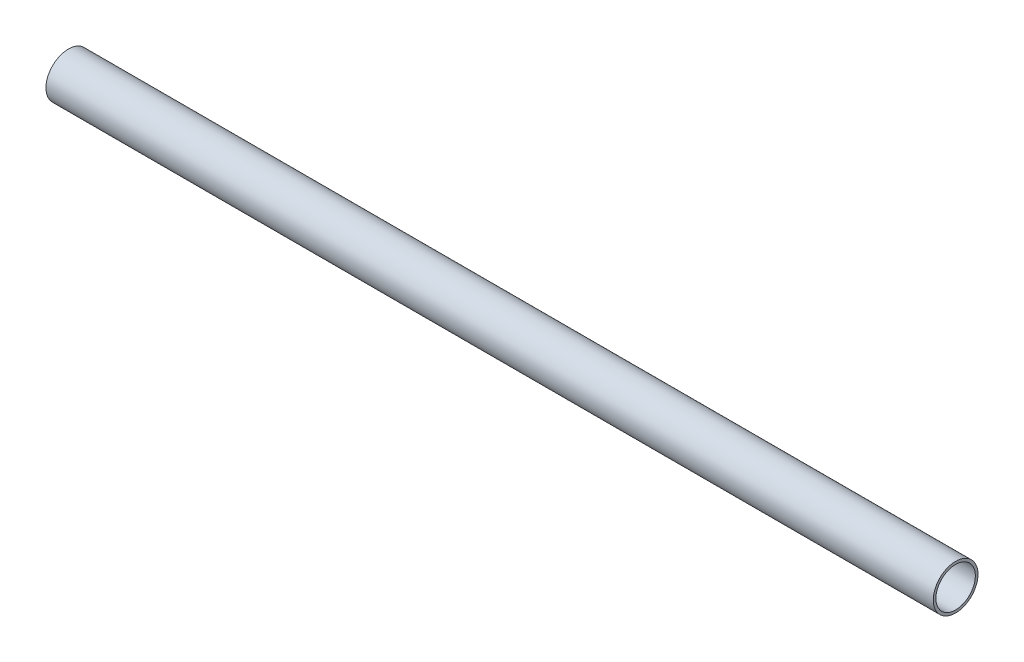
from build123d import *

# Parameters (mm, degrees)
SKETCH4_R   = 8.9662
SKETCH4_R_2 = 7.8994


with BuildPart() as part:
    # Sweep2: sweep along a path in Sketch3
    with BuildLine(Plane.XY) as sweep2_path:
        Line((0, 0), (355.6, 0))
    # Sketch4 → Sweep2 (sweep)
    with BuildSketch(Plane(origin=(0, 0, 0), x_dir=(0, 0, -1), z_dir=(1, 0, 0))):
        Circle(SKETCH4_R)
        Circle(SKETCH4_R_2, mode=Mode.SUBTRACT)
    sweep(path=sweep2_path.line)


solid = part.part
